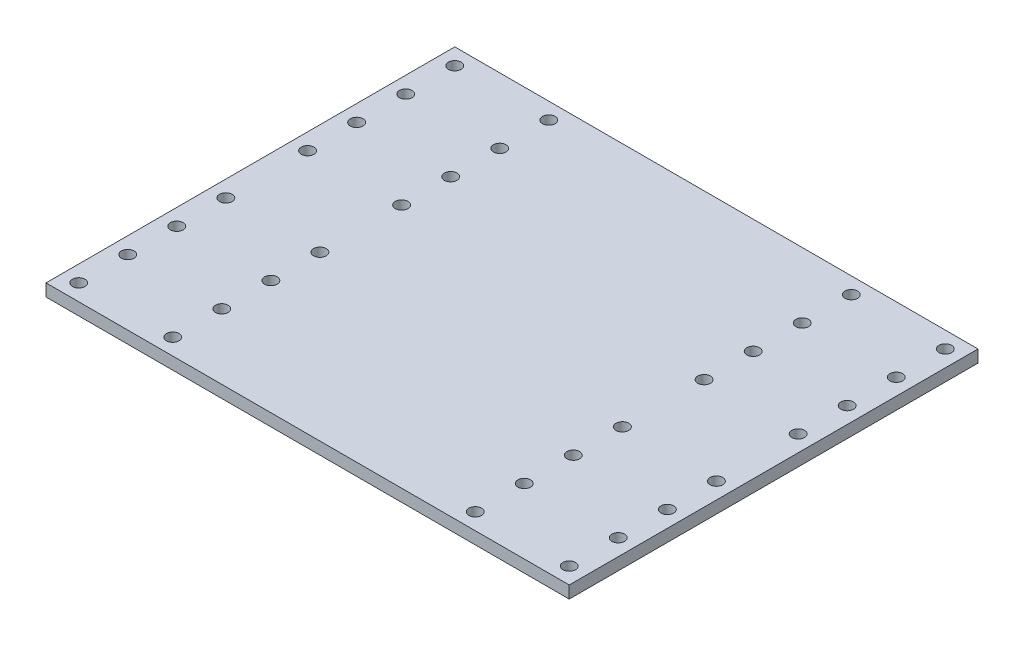
from build123d import *

# Parameters (mm, degrees)
SKETCH_1_W      = 128
SKETCH_1_H      = 100
SKETCH_1_R      = 1.55
EXTRUDE_1_DEPTH = 3


with BuildPart() as part:
    # 草图1 → 凸台-拉伸1 (new body)
    with BuildSketch(Plane(origin=(0, 0, 0), x_dir=(1, 0, 0), z_dir=(0, 1, 0))):
        Rectangle(SKETCH_1_W, SKETCH_1_H)
        with Locations(Location((-60, -46, 0), (0, 0, 270))):
            Circle(SKETCH_1_R, mode=Mode.SUBTRACT)
        with Locations(Location((-37, -46, 0), (0, 0, 270))):
            Circle(SKETCH_1_R, mode=Mode.SUBTRACT)
        with Locations(Location((-37, -34, 0), (0, 0, 270))):
            Circle(SKETCH_1_R, mode=Mode.SUBTRACT)
        with Locations(Location((-60, -34, 0), (0, 0, 270))):
            Circle(SKETCH_1_R, mode=Mode.SUBTRACT)
        with Locations(Location((-37, -10, 0), (0, 0, 270))):
            Circle(SKETCH_1_R, mode=Mode.SUBTRACT)
        with Locations(Location((-37, -22, 0), (0, 0, 270))):
            Circle(SKETCH_1_R, mode=Mode.SUBTRACT)
        with Locations(Location((-60, -10, 0), (0, 0, 270))):
            Circle(SKETCH_1_R, mode=Mode.SUBTRACT)
        with Locations(Location((-60, -22, 0), (0, 0, 270))):
            Circle(SKETCH_1_R, mode=Mode.SUBTRACT)
        with Locations(Location((60, -34, 0), (0, 0, 90))):
            Circle(SKETCH_1_R, mode=Mode.SUBTRACT)
        with Locations(Location((60, -46, 0), (0, 0, 90))):
            Circle(SKETCH_1_R, mode=Mode.SUBTRACT)
        with Locations(Location((37, -46, 0), (0, 0, 90))):
            Circle(SKETCH_1_R, mode=Mode.SUBTRACT)
        with Locations(Location((37, -34, 0), (0, 0, 90))):
            Circle(SKETCH_1_R, mode=Mode.SUBTRACT)
        with Locations(Location((60, -22, 0), (0, 0, 90))):
            Circle(SKETCH_1_R, mode=Mode.SUBTRACT)
        with Locations(Location((37, -22, 0), (0, 0, 90))):
            Circle(SKETCH_1_R, mode=Mode.SUBTRACT)
        with Locations(Location((37, -10, 0), (0, 0, 90))):
            Circle(SKETCH_1_R, mode=Mode.SUBTRACT)
        with Locations(Location((60, -10, 0), (0, 0, 90))):
            Circle(SKETCH_1_R, mode=Mode.SUBTRACT)
        with Locations(Location((60, 10, 0), (0, 0, 270))):
            Circle(SKETCH_1_R, mode=Mode.SUBTRACT)
        with Locations(Location((37, 10, 0), (0, 0, 270))):
            Circle(SKETCH_1_R, mode=Mode.SUBTRACT)
        with Locations(Location((37, 22, 0), (0, 0, 270))):
            Circle(SKETCH_1_R, mode=Mode.SUBTRACT)
        with Locations(Location((60, 22, 0), (0, 0, 270))):
            Circle(SKETCH_1_R, mode=Mode.SUBTRACT)
        with Locations(Location((60, 34, 0), (0, 0, 270))):
            Circle(SKETCH_1_R, mode=Mode.SUBTRACT)
        with Locations(Location((60, 46, 0), (0, 0, 270))):
            Circle(SKETCH_1_R, mode=Mode.SUBTRACT)
        with Locations(Location((37, 34, 0), (0, 0, 270))):
            Circle(SKETCH_1_R, mode=Mode.SUBTRACT)
        with Locations(Location((37, 46, 0), (0, 0, 270))):
            Circle(SKETCH_1_R, mode=Mode.SUBTRACT)
        with Locations(Location((-60, 46, 0), (0, 0, 90))):
            Circle(SKETCH_1_R, mode=Mode.SUBTRACT)
        with Locations(Location((-37, 46, 0), (0, 0, 90))):
            Circle(SKETCH_1_R, mode=Mode.SUBTRACT)
        with Locations(Location((-37, 34, 0), (0, 0, 90))):
            Circle(SKETCH_1_R, mode=Mode.SUBTRACT)
        with Locations(Location((-60, 34, 0), (0, 0, 90))):
            Circle(SKETCH_1_R, mode=Mode.SUBTRACT)
        with Locations(Location((-60, 22, 0), (0, 0, 90))):
            Circle(SKETCH_1_R, mode=Mode.SUBTRACT)
        with Locations(Location((-37, 22, 0), (0, 0, 90))):
            Circle(SKETCH_1_R, mode=Mode.SUBTRACT)
        with Locations(Location((-37, 10, 0), (0, 0, 90))):
            Circle(SKETCH_1_R, mode=Mode.SUBTRACT)
        with Locations(Location((-60, 10, 0), (0, 0, 90))):
            Circle(SKETCH_1_R, mode=Mode.SUBTRACT)
    extrude(amount=EXTRUDE_1_DEPTH)


solid = part.part
